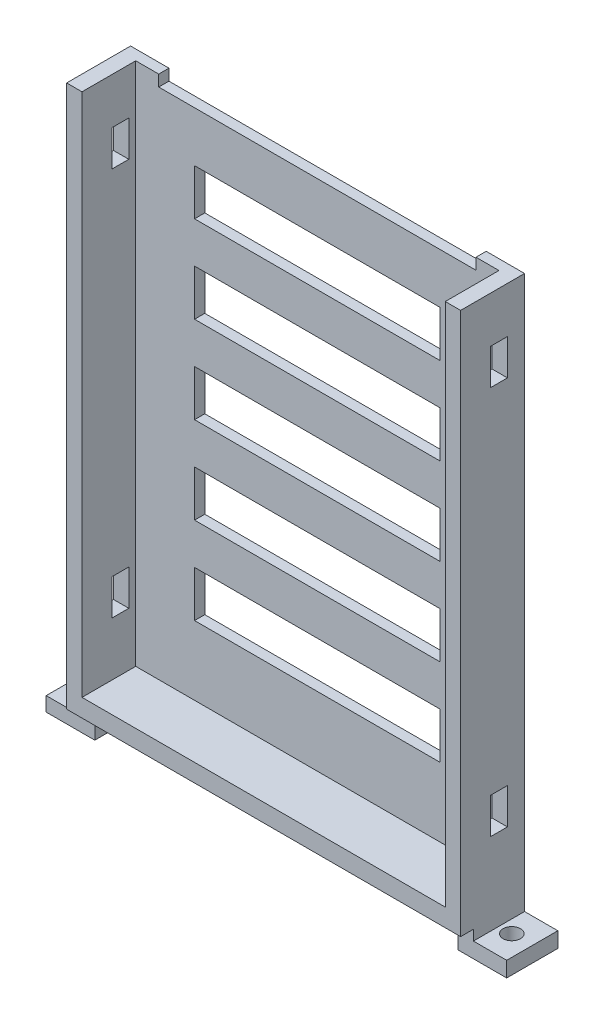
from build123d import *

# Parameters (mm, degrees)
SKETCH_1_W                          = 77
SKETCH_1_H                          = 106
TRAY_FLOOR_1_DEPTH                  = 2
SKETCH_2_W                          = 3
SKETCH_2_H                          = 106
LEFT_RETAINER_2_DEPTH               = 10.5
SKETCH_3_W                          = 3
SKETCH_3_H                          = 106
RIGHT_RETAINER_3_DEPTH              = 10.5
SKETCH_4_W                          = 71
SKETCH_4_H                          = 3.5
FRONT_RETAINER_4_DEPTH              = 10.5
SKETCH_5_W                          = 22
SKETCH_5_H                          = 8
PULL_HANDLE_5_DEPTH                 = 4
SKETCH_6_W                          = 3
SKETCH_6_H                          = 5
LEFT_EAR_BRIDGE_6_DEPTH             = 10
SKETCH_7_W                          = 3
SKETCH_7_H                          = 5
RIGHT_EAR_BRIDGE_7_DEPTH            = 10
SKETCH_8_W                          = 9.5
SKETCH_8_H                          = 3.5
LEFT_LOCK_EAR_8_DEPTH               = 10
SKETCH_9_W                          = 9.5
SKETCH_9_H                          = 3
RIGHT_LOCK_EAR_9_DEPTH              = 10
SKETCH_10_R                         = 1.7
TRAY_LOCK_M3_CLEARANCE_10_DEPTH     = 5
SKETCH_11_W                         = 48
SKETCH_11_H                         = 9
TRAY_AIRFLOW_11_DEPTH               = 4
SKETCH_12_R                         = 1.65
DRIVE_SIDE_M3_12_DEPTH              = 80
SKETCH_13_W                         = 14
SKETCH_13_H                         = 3
HANDLE_GRIP_13_DEPTH                = 6
SKETCH_14_W                         = 7.5
SKETCH_14_H                         = 4.2
LEFT_FLANGE_CLEARANCE_1_DEPTH       = 15
SKETCH_16_W                         = 3.3
SKETCH_16_H                         = 7
FRONT_ADJUSTABLE_M3_SLOT_1_DEPTH    = 80
SKETCH_17_W                         = 3.3
SKETCH_17_H                         = 7
REAR_ADJUSTABLE_M3_SLOT_2_DEPTH     = 80
SKETCH_18_W                         = 62
SKETCH_18_H                         = 3.2
SATA_PLUG_LOWER_CLEARANCE_301_DEPTH = 5


with BuildPart() as part:
    # Эскиз1 → Tray_floor_1 (new body)
    with BuildSketch(Plane.XY):
        with Locations((0, -9)):
            Rectangle(SKETCH_1_W, SKETCH_1_H)
    extrude(amount=TRAY_FLOOR_1_DEPTH)

    # Эскиз2 → Left_retainer_2 (add)
    with BuildSketch(Plane.XY.offset(2)):
        with Locations((-37, -9)):
            Rectangle(SKETCH_2_W, SKETCH_2_H)
    extrude(amount=LEFT_RETAINER_2_DEPTH)

    # Эскиз3 → Right_retainer_3 (add)
    with BuildSketch(Plane.XY.offset(2)):
        with Locations((37, -9)):
            Rectangle(SKETCH_3_W, SKETCH_3_H)
    extrude(amount=RIGHT_RETAINER_3_DEPTH)

    # Эскиз4 → Front_retainer_4 (add)
    with BuildSketch(Plane.XY.offset(2)):
        with Locations((0, -60.25)):
            Rectangle(SKETCH_4_W, SKETCH_4_H)
    extrude(amount=FRONT_RETAINER_4_DEPTH)

    # Эскиз5 → Pull_handle_5 (add)
    with BuildSketch(Plane.XY):
        with Locations((0, -66)):
            Rectangle(SKETCH_5_W, SKETCH_5_H)
    extrude(amount=PULL_HANDLE_5_DEPTH)

    # Эскиз6 → Left_ear_bridge_6 (add)
    with BuildSketch(Plane.XY):
        with Locations((-37, -62.5)):
            Rectangle(SKETCH_6_W, SKETCH_6_H)
    extrude(amount=LEFT_EAR_BRIDGE_6_DEPTH)

    # Эскиз7 → Right_ear_bridge_7 (add)
    with BuildSketch(Plane.XY):
        with Locations((37, -62.5)):
            Rectangle(SKETCH_7_W, SKETCH_7_H)
    extrude(amount=RIGHT_EAR_BRIDGE_7_DEPTH)

    # Эскиз8 → Left_lock_ear_8 (add)
    with BuildSketch(Plane.XY):
        with Locations((-40.25, -65.25)):
            Rectangle(SKETCH_8_W, SKETCH_8_H)
    extrude(amount=LEFT_LOCK_EAR_8_DEPTH)

    # Эскиз9 → Right_lock_ear_9 (add)
    with BuildSketch(Plane.XY):
        with Locations((40.25, -65.5)):
            Rectangle(SKETCH_9_W, SKETCH_9_H)
    extrude(amount=RIGHT_LOCK_EAR_9_DEPTH)

    # Эскиз10 → Tray_lock_M3_clearance_10 (cut)
    with BuildSketch(Plane(origin=(0, -68, 0), x_dir=(1, 0, 0), z_dir=(0, 1, 0))):
        with Locations(Location((-41, -5, 0), (0, 0, 90))):
            Circle(SKETCH_10_R)
        with Locations(Location((41, -5, 0), (0, 0, 90))):
            Circle(SKETCH_10_R)
    extrude(amount=TRAY_LOCK_M3_CLEARANCE_10_DEPTH, mode=Mode.SUBTRACT)

    # Эскиз11 → Tray_airflow_11 (cut)
    with BuildSketch(Plane.XY.offset(-1)):
        with Locations((0, -40.5)):
            Rectangle(SKETCH_11_W, SKETCH_11_H)
        with Locations((0, -23.5)):
            Rectangle(SKETCH_11_W, SKETCH_11_H)
        with Locations((0, -6.5)):
            Rectangle(SKETCH_11_W, SKETCH_11_H)
        with Locations((0, 10.5)):
            Rectangle(SKETCH_11_W, SKETCH_11_H)
        with Locations((0, 27.5)):
            Rectangle(SKETCH_11_W, SKETCH_11_H)
    extrude(amount=TRAY_AIRFLOW_11_DEPTH, mode=Mode.SUBTRACT)

    # Эскиз12 → Drive_side_M3_12 (cut)
    with BuildSketch(Plane(origin=(-40, 0, 0), x_dir=(0, 0, -1), z_dir=(1, 0, 0))):
        with Locations(Location((-5, -45.55, 0), (0, 0, 180))):
            Circle(SKETCH_12_R)
        with Locations(Location((-5, 31.05, 0), (0, 0, 180))):
            Circle(SKETCH_12_R)
    extrude(amount=DRIVE_SIDE_M3_12_DEPTH, mode=Mode.SUBTRACT)

    # Эскиз13 → Handle_grip_13 (cut)
    with BuildSketch(Plane.XY.offset(-1)):
        with Locations((0, -66.5)):
            Rectangle(SKETCH_13_W, SKETCH_13_H)
    extrude(amount=HANDLE_GRIP_13_DEPTH, mode=Mode.SUBTRACT)

    # Эскиз14 → Left_flange_clearance_1 (cut)
    with BuildSketch(Plane.XY.offset(-1)):
        with Locations((-42.25, -62.1)):
            Rectangle(SKETCH_14_W, SKETCH_14_H)
    extrude(amount=LEFT_FLANGE_CLEARANCE_1_DEPTH, mode=Mode.SUBTRACT)

    # Эскиз16 → Front_adjustable_M3_slot_1 (cut)
    with BuildSketch(Plane(origin=(-40, 0, 0), x_dir=(0, 0, -1), z_dir=(1, 0, 0))):
        with Locations((-5, -44.5)):
            Rectangle(SKETCH_16_W, SKETCH_16_H)
    extrude(amount=FRONT_ADJUSTABLE_M3_SLOT_1_DEPTH, mode=Mode.SUBTRACT)

    # Эскиз17 → Rear_adjustable_M3_slot_2 (cut)
    with BuildSketch(Plane(origin=(-40, 0, 0), x_dir=(0, 0, -1), z_dir=(1, 0, 0))):
        with Locations((-5, 31.5)):
            Rectangle(SKETCH_17_W, SKETCH_17_H)
    extrude(amount=REAR_ADJUSTABLE_M3_SLOT_2_DEPTH, mode=Mode.SUBTRACT)

    # Эскиз18 → SATA_plug_lower_clearance_301 (cut)
    with BuildSketch(Plane.XY.offset(-1)):
        with Locations((0, 43.4)):
            Rectangle(SKETCH_18_W, SKETCH_18_H)
    extrude(amount=SATA_PLUG_LOWER_CLEARANCE_301_DEPTH, mode=Mode.SUBTRACT)


solid = part.part
